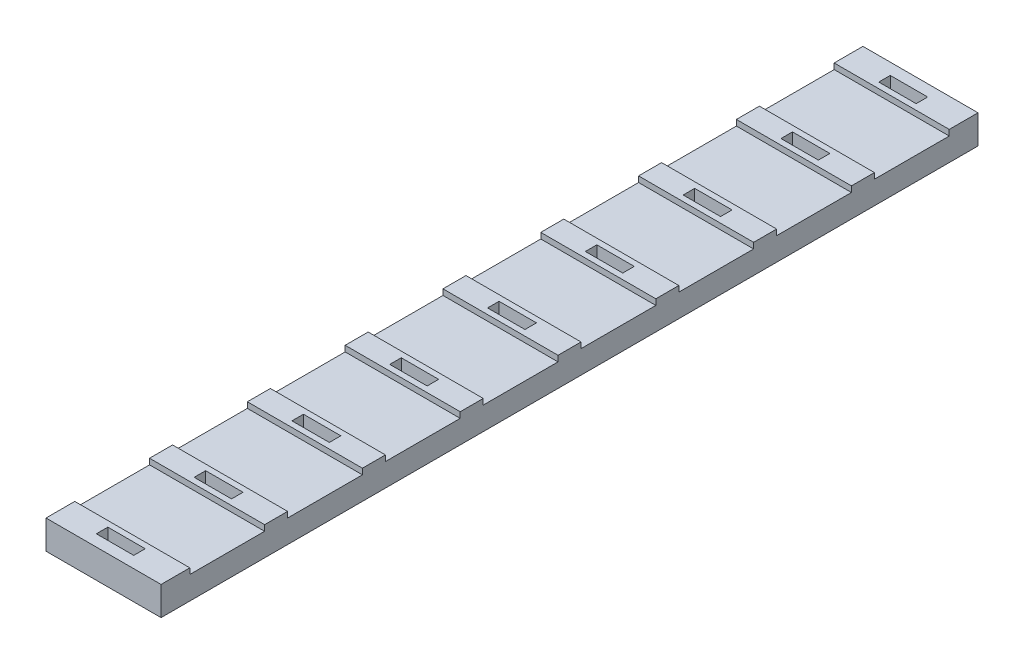
from build123d import *

# Parameters (mm, degrees)
SKETCH1_W              = 20
SKETCH1_H              = 142
BOSS_EXTRUDE1_DEPTH    = 7
SKETCH2_W              = 20
SKETCH2_H              = 13
CUT_EXTRUDE1_DEPTH     = 3
LPATTERN1_COUNT        = 8
LPATTERN1_PITCH        = 17
CUT_EXTRUDE2_REACH     = 74.042
SKETCH4_W              = 6.5
SKETCH4_H              = 2
FILLET1_R              = 0.5
CHAMFER1_SIZE          = 2
LPATTERN2_COUNT        = 9
LPATTERN2_PITCH        = 17
FILLET1_OF_LPATTERN2_R = 0.5
SKETCH5_W              = 6.5
SKETCH5_H              = 15
CUT_EXTRUDE3_DEPTH     = 2
LPATTERN3_COUNT        = 8
LPATTERN3_PITCH        = 17
CUT_EXTRUDE4_REACH     = 144.524
SKETCH6_W              = 20
SKETCH6_H              = 2


with BuildPart() as part:
    # Sketch1 → Boss-Extrude1 (new body)
    with BuildSketch(Plane(origin=(0, 0, 0), x_dir=(1, 0, 0), z_dir=(0, 1, 0))):
        Rectangle(SKETCH1_W, SKETCH1_H)
    extrude(amount=BOSS_EXTRUDE1_DEPTH)

    # Sketch2 → Cut-Extrude1 (cut)
    with BuildSketch(Plane(origin=(0, 7, 0), x_dir=(1, 0, 0), z_dir=(0, 1, 0))):
        with Locations((0, 59.5)):
            Rectangle(SKETCH2_W, SKETCH2_H)
    cut_extrude1 = extrude(amount=-CUT_EXTRUDE1_DEPTH, mode=Mode.SUBTRACT)

    # LPattern1: Cut-Extrude1 ×8
    with Locations(*[(0, 0, i * LPATTERN1_PITCH) for i in range(1, LPATTERN1_COUNT)]):
        add(cut_extrude1, mode=Mode.SUBTRACT)

    # Sketch4 → Cut-Extrude2 (cut, up to next)
    with BuildSketch(Plane(origin=(0, 7, 0), x_dir=(1, 0, 0), z_dir=(0, 1, 0)), mode=Mode.PRIVATE) as cut_extrude2_sk1:
        with Locations((0, 68)):
            Rectangle(SKETCH4_W, SKETCH4_H)
    cut_extrude2_tool1 = extrude(cut_extrude2_sk1.sketch, amount=-CUT_EXTRUDE2_REACH, mode=Mode.PRIVATE) & part.part
    cut_extrude2 = cut_extrude2_tool1.solids().sort_by_distance((0, 7, -68))[0]
    add(cut_extrude2, mode=Mode.SUBTRACT)

    # Fillet1
    fillet1_edges = [part.edges().sort_by_distance(p)[0] for p in [
        (0, 7, -67),
        (0, 7, -69),
    ]]
    fillet(fillet1_edges, radius=FILLET1_R)

    # Chamfer1
    chamfer1_edges = [part.edges().sort_by_distance(p)[0] for p in [
        (-10, 7, -68.5),
        (10, 7, -68.5),
        (-10, 7, -51),
        (10, 7, 51),
        (10, 7, 34),
        (10, 7, 17),
        (10, 7, 0),
        (10, 7, -17),
        (10, 7, -34),
        (10, 7, -51),
        (-10, 7, -34),
        (-10, 7, -17),
        (-10, 7, 0),
        (-10, 7, 17),
        (-10, 7, 34),
        (-10, 7, 51),
        (-10, 7, 68.5),
        (10, 7, 68.5),
    ]]
    chamfer(chamfer1_edges, length=CHAMFER1_SIZE)

    # LPattern2: Cut-Extrude2 ×9
    with Locations(*[(0, 0, i * LPATTERN2_PITCH) for i in range(1, LPATTERN2_COUNT)]):
        add(cut_extrude2, mode=Mode.SUBTRACT)

    # Fillet1 of LPattern2
    fillet1_of_lpattern2_edges = [part.edges().sort_by_distance(p)[0] for p in [
        (0, 7, -50),
        (0, 7, -52),
        (0, 7, -33),
        (0, 7, -35),
        (0, 7, -16),
        (0, 7, -18),
        (0, 7, 1),
        (0, 7, -1),
        (0, 7, 18),
        (0, 7, 16),
        (0, 7, 35),
        (0, 7, 33),
        (0, 7, 52),
        (0, 7, 50),
        (0, 7, 69),
        (0, 7, 67),
    ]]
    fillet(fillet1_of_lpattern2_edges, radius=FILLET1_OF_LPATTERN2_R)

    # Sketch5 → Cut-Extrude3 (cut)
    with BuildSketch(Plane.XZ):
        with Locations((0, 59.5)):
            Rectangle(SKETCH5_W, SKETCH5_H)
    cut_extrude3 = extrude(amount=-CUT_EXTRUDE3_DEPTH, mode=Mode.SUBTRACT)

    # LPattern3: Cut-Extrude3 ×8
    with Locations(*[(0, 0, -i * LPATTERN3_PITCH) for i in range(1, LPATTERN3_COUNT)]):
        add(cut_extrude3, mode=Mode.SUBTRACT)

    # Cut-Extrude4: up to this face of the body (flat: up to its plane)
    cut_extrude4_end = Plane(part.part.faces().sort_by_distance((0, 3.416666667, 71))[0])
    # Sketch6 → Cut-Extrude4 (cut, up to the picked face)
    with BuildSketch(Plane(origin=(0, 0, -71), x_dir=(-1, 0, 0), z_dir=(0, 0, -1)), mode=Mode.PRIVATE) as cut_extrude4_sk1:
        with Locations((0, 6)):
            Rectangle(SKETCH6_W, SKETCH6_H)
    cut_extrude4_tool1 = split(extrude(cut_extrude4_sk1.sketch, amount=-CUT_EXTRUDE4_REACH, mode=Mode.PRIVATE), bisect_by=cut_extrude4_end, keep=Keep.BOTH, mode=Mode.PRIVATE)
    add(cut_extrude4_tool1.solids().sort_by(Axis((0, 6, -71), (0, 0, 1)))[0], mode=Mode.SUBTRACT)


solid = part.part
